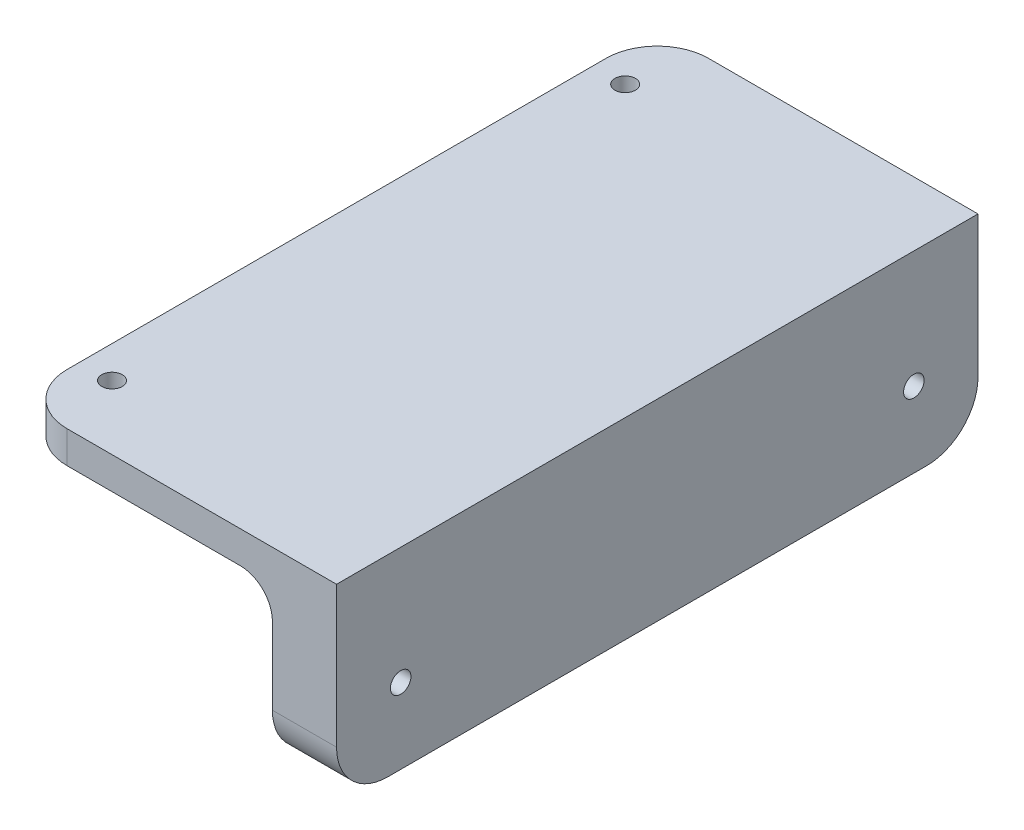
from build123d import *

# Parameters (mm, degrees)
CROQUIS1_W              = 50
CROQUIS1_H              = 100
CROQUIS1_R              = 1.6
SALIENTE_EXTRUIR1_DEPTH = 5
CROQUIS2_W              = 10
CROQUIS2_H              = 100
SALIENTE_EXTRUIR2_DEPTH = 25
CROQUIS3_R              = 1.6
CORTAR_EXTRUIR1_DEPTH   = 10
CORTAR_EXTRUIR2_DEPTH   = 1
REDONDEO1_R             = 8
CROQUIS5_W              = 60
CROQUIS5_H              = 15
SALIENTE_EXTRUIR3_DEPTH = 30
REDONDEO2_R             = 5
CROQUIS6_R              = 2.8
CORTAR_EXTRUIR3_DEPTH   = 1.5


with BuildPart() as part:
    # Croquis1 → Saliente-Extruir1 (new body)
    with BuildSketch(Plane(origin=(0, 0, 0), x_dir=(1, 0, 0), z_dir=(0, 1, 0))):
        with Locations((25, -50)):
            Rectangle(CROQUIS1_W, CROQUIS1_H)
        with Locations(Location((5, -10, 0), (0, 0, 270))):
            Circle(CROQUIS1_R, mode=Mode.SUBTRACT)
        with Locations(Location((5, -90, 0), (0, 0, 270))):
            Circle(CROQUIS1_R, mode=Mode.SUBTRACT)
    extrude(amount=SALIENTE_EXTRUIR1_DEPTH)

    # Croquis2 → Saliente-Extruir2 (add)
    with BuildSketch(Plane.XZ):
        with Locations((45, 50)):
            Rectangle(CROQUIS2_W, CROQUIS2_H)
    extrude(amount=SALIENTE_EXTRUIR2_DEPTH)

    # Croquis3 → Cortar-Extruir1 (cut)
    with BuildSketch(Plane.ZY.offset(-40)):
        with Locations((10, -13.25)):
            Circle(CROQUIS3_R)
        with Locations((90, -13.25)):
            Circle(CROQUIS3_R)
    extrude(amount=-CORTAR_EXTRUIR1_DEPTH, mode=Mode.SUBTRACT)

    # Croquis4 → Cortar-Extruir2 (cut)
    with BuildSketch(Plane.XZ):
        Polygon((3.325684219, 7.1), (6.674315781, 7.1), (8.348631561, 10), (6.674315781, 12.9), (3.325684219, 12.9), (1.651368439, 10), align=None)
        Polygon((3.325684219, 87.1), (6.674315781, 87.1), (8.348631561, 90), (6.674315781, 92.9), (3.325684219, 92.9), (1.651368439, 90), align=None)
    extrude(amount=-CORTAR_EXTRUIR2_DEPTH, mode=Mode.SUBTRACT)

    # Redondeo1
    redondeo1_edges = [part.edges().sort_by_distance(p)[0] for p in [
        (45, -25, 100),
        (45, -25, 0),
        (0, 2.5, 0),
        (0, 2.5, 100),
    ]]
    fillet(redondeo1_edges, radius=REDONDEO1_R)

    # Croquis5 → Saliente-Extruir3 (add)
    with BuildSketch(Plane.ZY.offset(-40)):
        with Locations((50, -7.5)):
            Rectangle(CROQUIS5_W, CROQUIS5_H)
    extrude(amount=SALIENTE_EXTRUIR3_DEPTH)

    # Redondeo2
    redondeo2_edges = [part.edges().sort_by_distance(p)[0] for p in [
        (40, 0, 10),
        (40, -7.5, 20),
        (25, 0, 20),
        (40, -15, 50),
        (40, -7.5, 80),
        (25, -15, 80),
        (25, 0, 80),
        (10, -15, 50),
        (10, 0, 50),
        (40, 0, 90),
    ]]
    fillet(redondeo2_edges, radius=REDONDEO2_R)

    # Croquis6 → Cortar-Extruir3 (cut)
    with BuildSketch(Plane.ZY.offset(-40)):
        with Locations((10, -13.25)):
            Circle(CROQUIS6_R)
        with Locations((90, -13.25)):
            Circle(CROQUIS6_R)
    extrude(amount=-CORTAR_EXTRUIR3_DEPTH, mode=Mode.SUBTRACT)


solid = part.part
